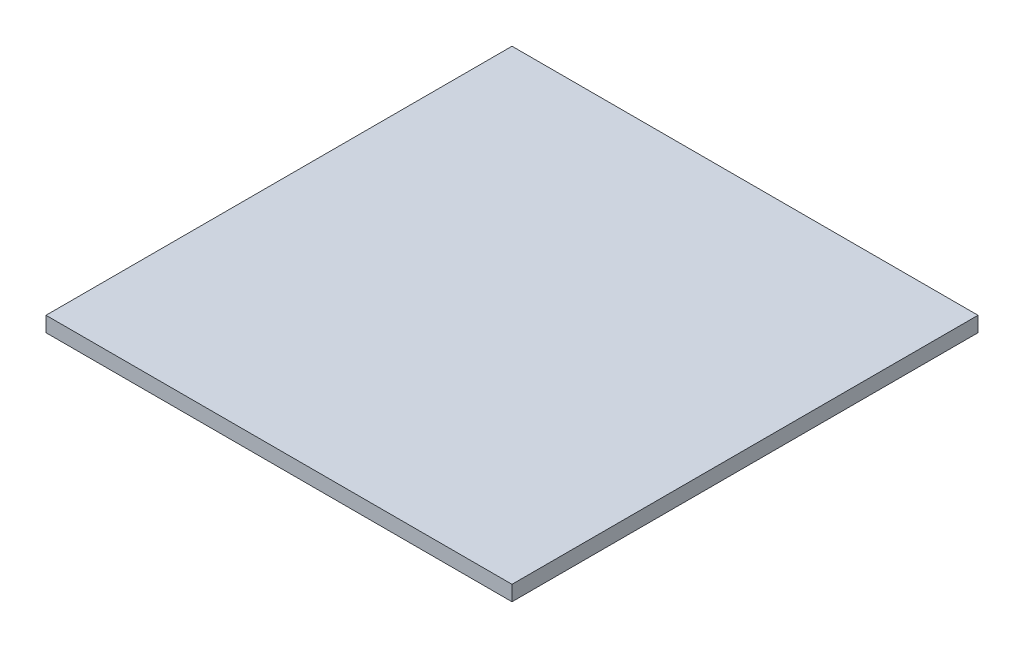
from build123d import *

# Parameters (mm, degrees)
SKETCH_1_W      = 400
SKETCH_1_H      = 400
EXTRUDE_1_DEPTH = 13


with BuildPart() as part:
    # 스케치1 → 보스-돌출1 (new body)
    with BuildSketch(Plane(origin=(0, 0, 0), x_dir=(1, 0, 0), z_dir=(0, 1, 0))):
        Rectangle(SKETCH_1_W, SKETCH_1_H)
    extrude(amount=EXTRUDE_1_DEPTH)


solid = part.part
